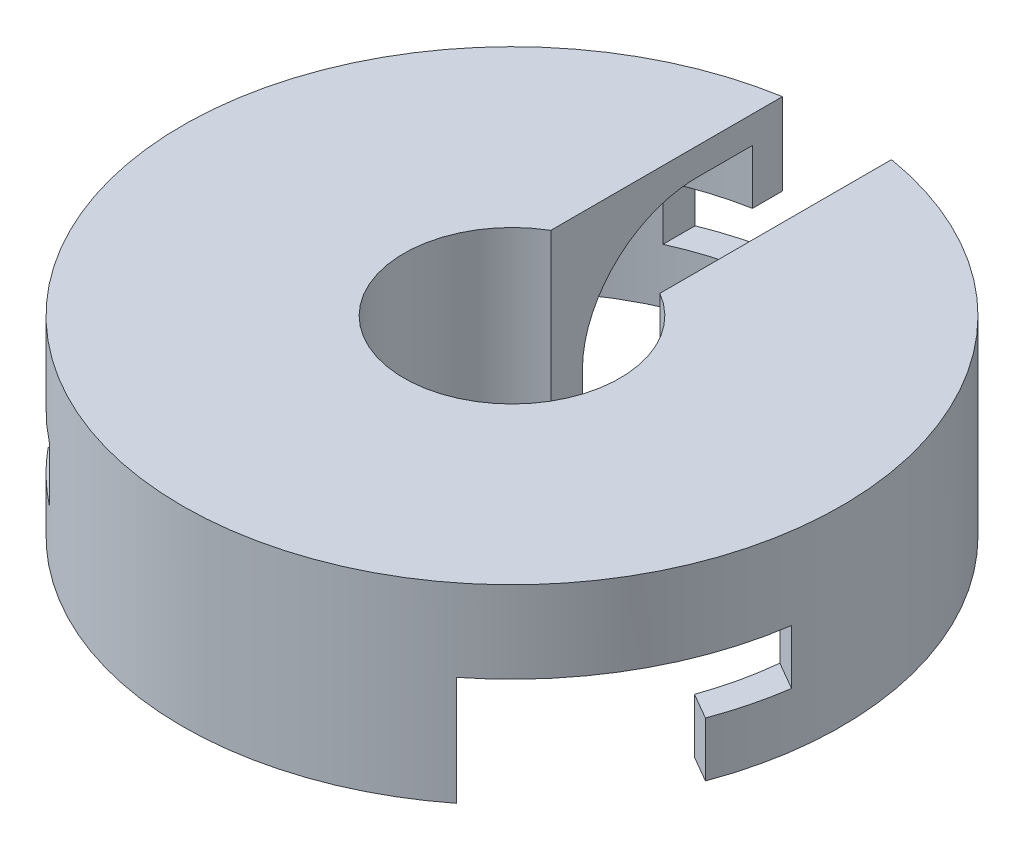
from build123d import *

# Parameters (mm, degrees)
BOSS_EXTRUDE3_DEPTH = 7
BOSS_EXTRUDE4_DEPTH = 1
BOSS_EXTRUDE5_DEPTH = 7
BOSS_EXTRUDE6_DEPTH = 3
BOSS_EXTRUDE7_START = -5
BOSS_EXTRUDE7_DEPTH = 2
FILLET1_R           = 4


with BuildPart() as part:
    # Sketch1 → Boss-Extrude3 (new body)
    with BuildSketch(Plane(origin=(0, 0, 0), x_dir=(1, 0, 0), z_dir=(0, 1, 0))):
        with BuildLine():
            Line((2, 4.582575695), (2, 3.422298687))
            ThreePointArc((2, 3.422298687), (0, -3.96385271), (-2, 3.422298687))
            Line((-2, 3.422298687), (-2, 4.582575695))
            ThreePointArc((-2, 4.582575695), (0, -5), (2, 4.582575695))
        make_face()
    extrude(amount=-BOSS_EXTRUDE3_DEPTH)

    # Sketch1<6> → Boss-Extrude4 (add)
    with BuildSketch(Plane(origin=(0, 0, 0), x_dir=(1, 0, 0), z_dir=(0, 1, 0))):
        with BuildLine():
            Line((2, 10.816653826), (2, 4.582575695))
            ThreePointArc((2, 4.582575695), (0, -5), (-2, 4.582575695))
            Line((-2, 4.582575695), (-2, 10.816653826))
            ThreePointArc((-2, 10.816653826), (0, -11), (2, 10.816653826))
        make_face()
    extrude(amount=-BOSS_EXTRUDE4_DEPTH)

    # Sketch1<7> → Boss-Extrude5 (add)
    with BuildSketch(Plane(origin=(0, 0, 0), x_dir=(1, 0, 0), z_dir=(0, 1, 0))):
        with BuildLine():
            ThreePointArc((-7.460787851, -9.503640297), (0, -12.082323214), (7.460787851, -9.503640297))
            Line((7.460787851, -9.503640297), (6.442669325, -8.915829292))
            ThreePointArc((6.442669325, -8.915829292), (0, -11), (-6.442669325, -8.915829292))
            Line((-6.442669325, -8.915829292), (-7.460787851, -9.503640297))
        make_face()
        with BuildLine():
            Line((10.942669325, -1.121600658), (11.960787851, -1.709411663))
            ThreePointArc((11.960787851, -1.709411663), (12.051901073, -0.856863332), (12.082323214, 0))
            ThreePointArc((12.082323214, 0), (10.008820827, 6.768015949), (4.5, 11.21305196))
            Line((4.5, 11.21305196), (4.5, 10.03742995))
            ThreePointArc((4.5, 10.03742995), (9.233092656, 5.979130372), (11, 0))
            ThreePointArc((11, 0), (10.985657982, -0.561532466), (10.942669325, -1.121600658))
        make_face()
        with BuildLine():
            ThreePointArc((-4.5, 11.21305196), (-10.46359884, 6.041161607), (-11.960787851, -1.709411663))
            Line((-11.960787851, -1.709411663), (-10.942669325, -1.121600658))
            ThreePointArc((-10.942669325, -1.121600658), (-9.526279442, 5.5), (-4.5, 10.03742995))
            Line((-4.5, 10.03742995), (-4.5, 11.21305196))
        make_face()
    extrude(amount=-BOSS_EXTRUDE5_DEPTH)

    # Sketch1<8> → Boss-Extrude6 (add)
    with BuildSketch(Plane(origin=(0, 0, 0), x_dir=(1, 0, 0), z_dir=(0, 1, 0))):
        with BuildLine():
            Line((11.960787851, -1.709411663), (10.942669325, -1.121600658))
            ThreePointArc((10.942669325, -1.121600658), (9.526279442, -5.5), (6.442669325, -8.915829292))
            Line((6.442669325, -8.915829292), (7.460787851, -9.503640297))
            ThreePointArc((7.460787851, -9.503640297), (10.46359884, -6.041161607), (11.960787851, -1.709411663))
        make_face()
        with BuildLine():
            Line((4.5, 10.03742995), (4.5, 11.21305196))
            ThreePointArc((4.5, 11.21305196), (3.268930764, 11.631707781), (2, 11.915642419))
            Line((2, 11.915642419), (2, 10.816653826))
            ThreePointArc((2, 10.816653826), (3.273270148, 10.501699983), (4.5, 10.03742995))
        make_face()
        with BuildLine():
            Line((-7.460787851, -9.503640297), (-6.442669325, -8.915829292))
            ThreePointArc((-6.442669325, -8.915829292), (-9.526279442, -5.5), (-10.942669325, -1.121600658))
            Line((-10.942669325, -1.121600658), (-11.960787851, -1.709411663))
            ThreePointArc((-11.960787851, -1.709411663), (-10.46359884, -6.041161607), (-7.460787851, -9.503640297))
        make_face()
        with BuildLine():
            Line((-2, 10.816653826), (-2, 11.915642419))
            ThreePointArc((-2, 11.915642419), (-3.268930764, 11.631707781), (-4.5, 11.21305196))
            Line((-4.5, 11.21305196), (-4.5, 10.03742995))
            ThreePointArc((-4.5, 10.03742995), (-3.273270148, 10.501699983), (-2, 10.816653826))
        make_face()
    extrude(amount=-BOSS_EXTRUDE6_DEPTH)

    # Sketch1<9> → Boss-Extrude7 (add)
    with BuildSketch(Plane(origin=(0, 0, 0), x_dir=(1, 0, 0), z_dir=(0, 1, 0)).offset(BOSS_EXTRUDE7_START)):
        with BuildLine():
            ThreePointArc((-9.319249037, -7.689872017), (-8.438889046, -8.646830975), (-7.460787851, -9.503640297))
            Line((-7.460787851, -9.503640297), (-6.442669325, -8.915829292))
            ThreePointArc((-6.442669325, -8.915829292), (-7.458103894, -8.085585093), (-8.367496998, -7.140377721))
            Line((-8.367496998, -7.140377721), (-9.319249037, -7.689872017))
        make_face()
        with BuildLine():
            ThreePointArc((11.319249037, -4.225770402), (11.70781981, -2.984876806), (11.960787851, -1.709411663))
            Line((11.960787851, -1.709411663), (10.942669325, -1.121600658))
            ThreePointArc((10.942669325, -1.121600658), (10.731374042, -2.41611489), (10.367496998, -3.676276106))
            Line((10.367496998, -3.676276106), (11.319249037, -4.225770402))
        make_face()
        with BuildLine():
            Line((-2, 10.816653826), (-2, 11.915642419))
            ThreePointArc((-2, 11.915642419), (-3.268930764, 11.631707781), (-4.5, 11.21305196))
            Line((-4.5, 11.21305196), (-4.5, 10.03742995))
            ThreePointArc((-4.5, 10.03742995), (-3.273270148, 10.501699983), (-2, 10.816653826))
        make_face()
    extrude(amount=-BOSS_EXTRUDE7_DEPTH)

    # Fillet1
    fillet1_edges = [part.edges().sort_by_distance(p)[0] for p in [
        (0, -1, 5),
    ]]
    fillet(fillet1_edges, radius=FILLET1_R)


solid = part.part
